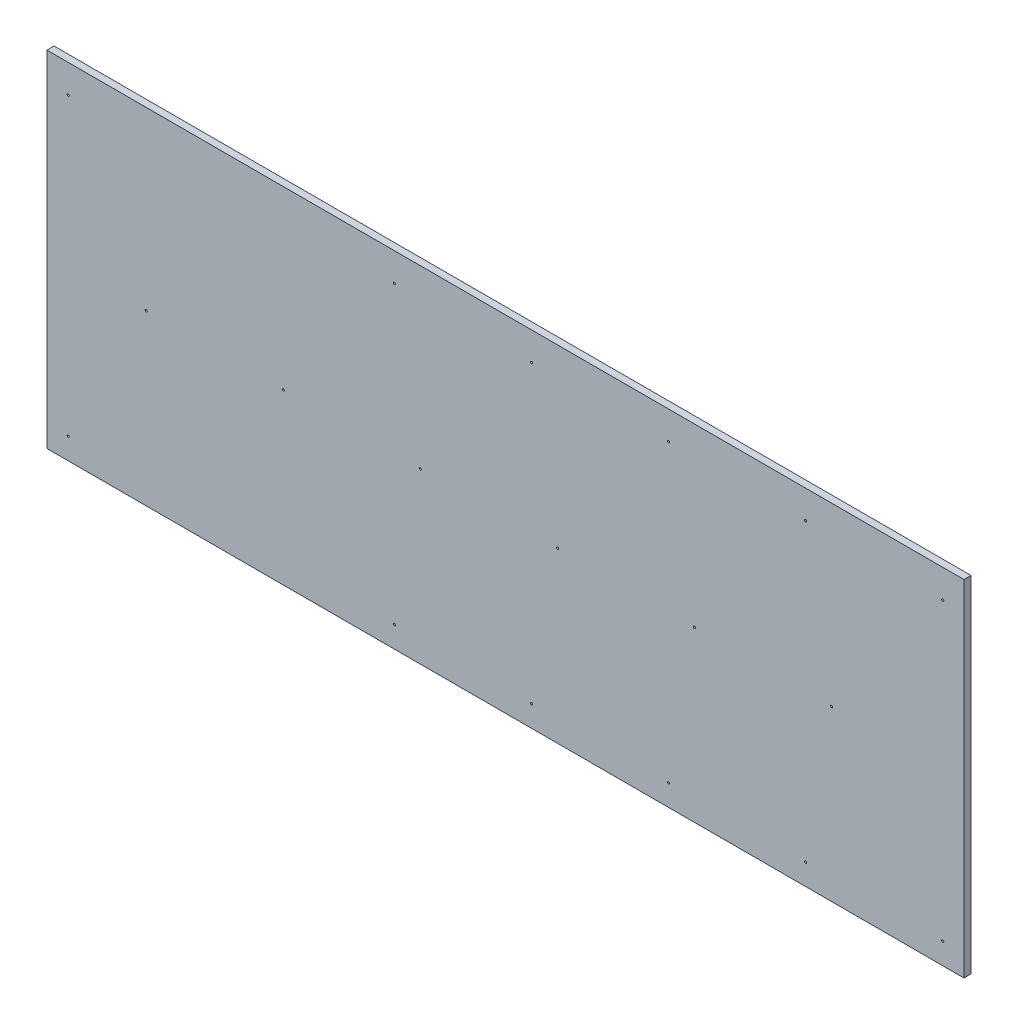
from build123d import *

# Parameters (mm, degrees)
SKETCH1_W           = 776
SKETCH1_H           = 292
BOSS_EXTRUDE1_DEPTH = 6
SKETCH2_R           = 0.9
CUT_EXTRUDE1_DEPTH  = 6


with BuildPart() as part:
    # Sketch1 → Boss-Extrude1 (new body)
    with BuildSketch(Plane.XY):
        Rectangle(SKETCH1_W, SKETCH1_H)
    extrude(amount=BOSS_EXTRUDE1_DEPTH)

    # Sketch2 → Cut-Extrude1 (cut)
    with BuildSketch(Plane(origin=(0, 0, 0), x_dir=(-1, 0, 0), z_dir=(0, 0, -1))):
        with Locations((-370, -128)):
            Circle(SKETCH2_R)
        with Locations((-370, 122)):
            Circle(SKETCH2_R)
        with Locations((370, -128)):
            Circle(SKETCH2_R)
        with Locations((370, 122)):
            Circle(SKETCH2_R)
        with Locations((-276, -3)):
            Circle(SKETCH2_R)
        with Locations((-254, -128)):
            Circle(SKETCH2_R)
        with Locations((-254, 122)):
            Circle(SKETCH2_R)
        with Locations((-160, -3)):
            Circle(SKETCH2_R)
        with Locations((-138, -128)):
            Circle(SKETCH2_R)
        with Locations((-138, 122)):
            Circle(SKETCH2_R)
        with Locations((-44, -3)):
            Circle(SKETCH2_R)
        with Locations((-22, -128)):
            Circle(SKETCH2_R)
        with Locations((-22, 122)):
            Circle(SKETCH2_R)
        with Locations((72, -3)):
            Circle(SKETCH2_R)
        with Locations((94, -128)):
            Circle(SKETCH2_R)
        with Locations((94, 122)):
            Circle(SKETCH2_R)
        with Locations((188, -3)):
            Circle(SKETCH2_R)
        with Locations((304, -3)):
            Circle(SKETCH2_R)
    extrude(amount=-CUT_EXTRUDE1_DEPTH, mode=Mode.SUBTRACT)


solid = part.part
